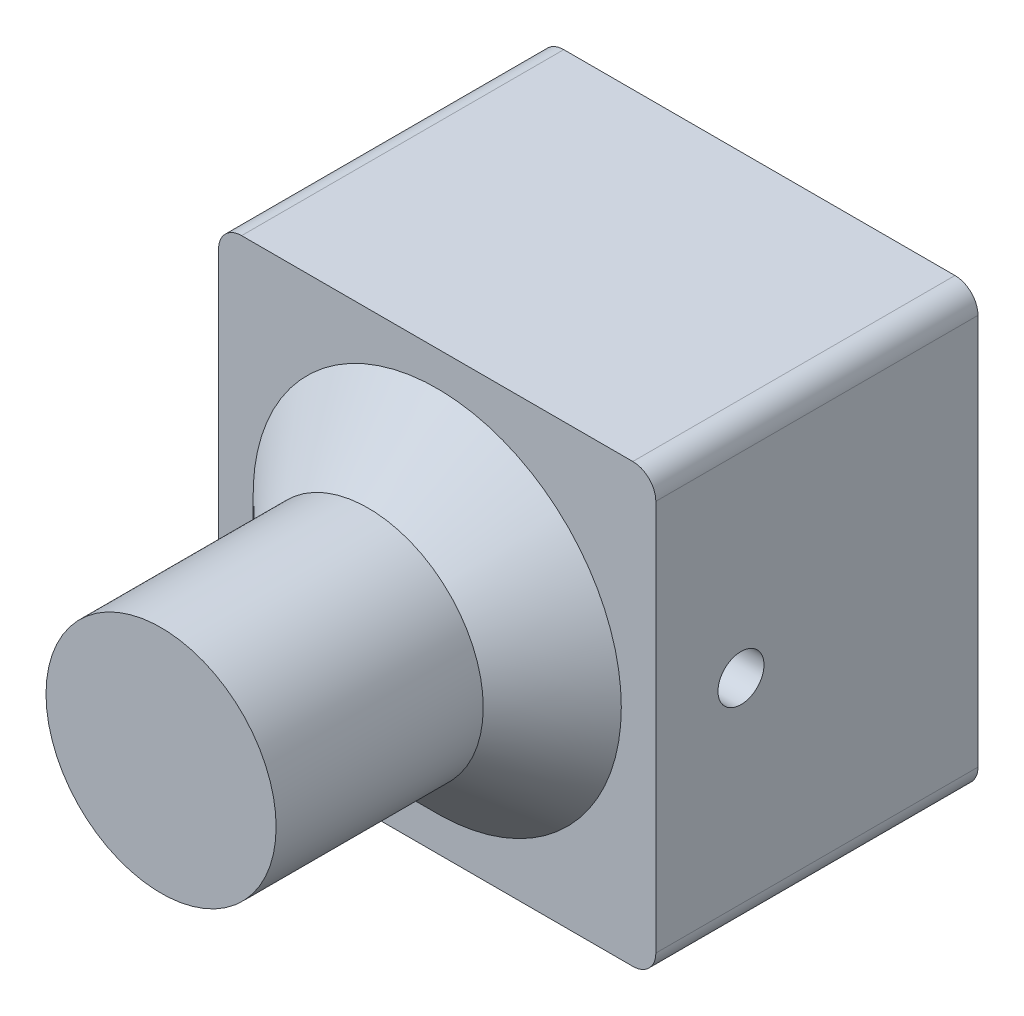
from build123d import *

# Parameters (mm, degrees)
SKETCH1_W           = 19
SKETCH1_H           = 19
BOSS_EXTRUDE1_DEPTH = 14
FILLET1_R           = 1
SKETCH2_R           = 5
BOSS_EXTRUDE2_DEPTH = 12
CHAMFER1_SIZE       = 3
SKETCH3_R           = 1
CUT_EXTRUDE1_DEPTH  = 5
CUT_EXTRUDE2_START  = -5
SKETCH4_R           = 1
CUT_EXTRUDE2_DEPTH  = 5


with BuildPart() as part:
    # Sketch1 → Boss-Extrude1 (new body)
    with BuildSketch(Plane.XY):
        with Locations((66.227433771, 51.961607523)):
            Rectangle(SKETCH1_W, SKETCH1_H)
    extrude(amount=BOSS_EXTRUDE1_DEPTH)

    # Fillet1
    fillet1_edges = [part.edges().sort_by_distance(p)[0] for p in [
        (56.727433771, 61.461607523, 7),
        (75.727433771, 61.461607523, 7),
        (75.727433771, 42.461607523, 7),
        (56.727433771, 42.461607523, 7),
    ]]
    fillet(fillet1_edges, radius=FILLET1_R)

    # Sketch2 → Boss-Extrude2 (add)
    with BuildSketch(Plane.XY.offset(14)):
        with Locations((66.227433771, 51.961607523)):
            Circle(SKETCH2_R)
    extrude(amount=BOSS_EXTRUDE2_DEPTH)

    # Chamfer1
    chamfer1_edges = [part.edges().sort_by_distance(p)[0] for p in [
        (61.227433771, 51.961607523, 14),
    ]]
    chamfer(chamfer1_edges, length=CHAMFER1_SIZE)

    # Sketch3 → Cut-Extrude1 (cut)
    with BuildSketch(Plane.ZY.offset(-56.727433771)):
        with Locations(Location((10.3, 51.961607523, 0), (0, 0, 270))):
            Circle(SKETCH3_R)
    extrude(amount=-CUT_EXTRUDE1_DEPTH, mode=Mode.SUBTRACT)

    # Sketch4 → Cut-Extrude2 (cut)
    with BuildSketch(Plane(origin=(75.727433771, 0, 0), x_dir=(0, 0, -1), z_dir=(1, 0, 0)).offset(CUT_EXTRUDE2_START)):
        with Locations(Location((-10.3, 51.961607523, 0), (0, 0, 270))):
            Circle(SKETCH4_R)
    extrude(amount=CUT_EXTRUDE2_DEPTH, mode=Mode.SUBTRACT)


solid = part.part
